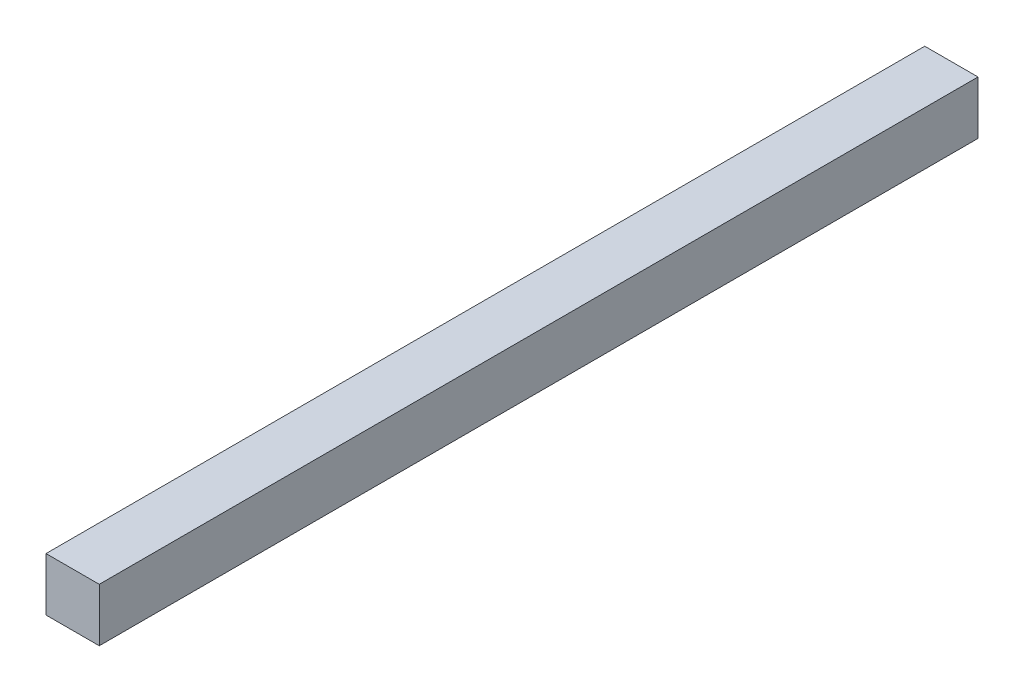
from build123d import *

# Parameters (mm, degrees)
SKETCH_1_W      = 20
SKETCH_1_H      = 20
EXTRUDE_1_DEPTH = 330


with BuildPart() as part:
    # 草图1 → 凸台-拉伸1 (new body)
    with BuildSketch(Plane.XY):
        with Locations((-10, 10)):
            Rectangle(SKETCH_1_W, SKETCH_1_H)
    extrude(amount=EXTRUDE_1_DEPTH)


solid = part.part
